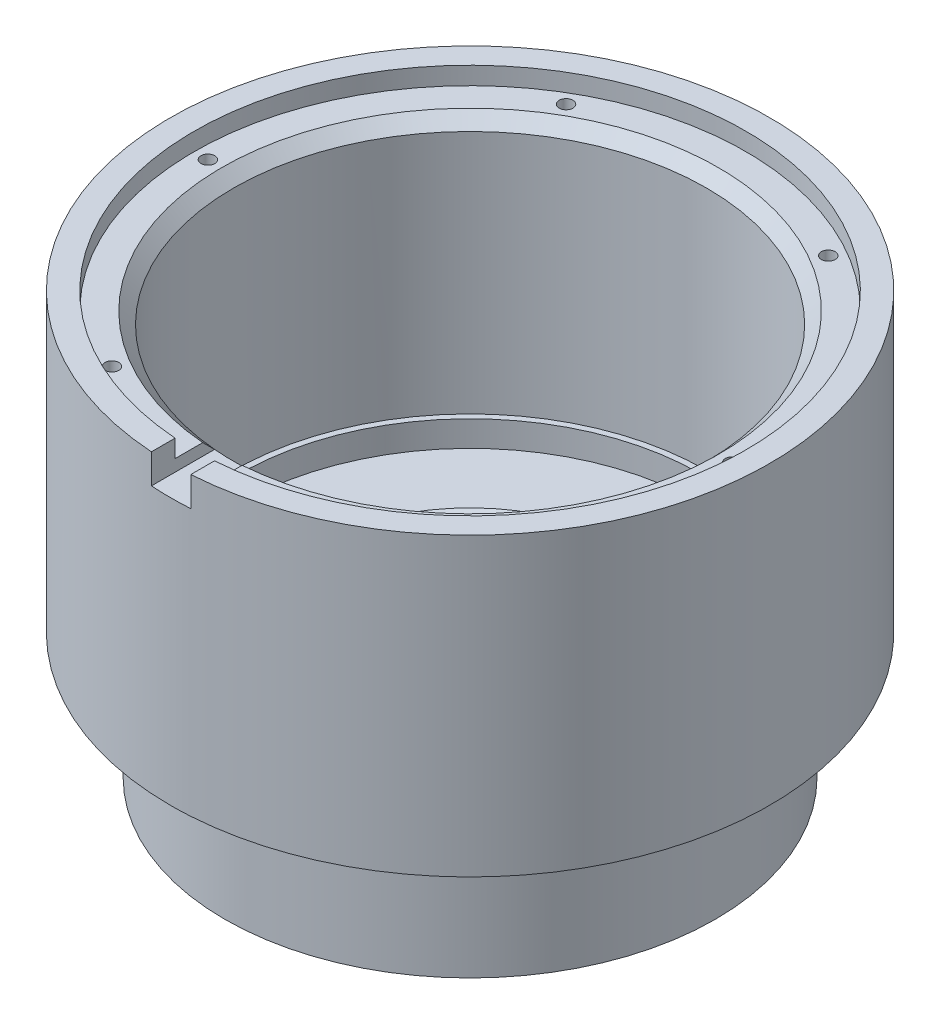
from build123d import *

# Parameters (mm, degrees)
CHAMFER1_SIZE     = 1.5
WIRE_START        = -3.75
SKETCH8_W         = 5
SKETCH8_H         = 8.104217416
WIRE_HOLE_DEPTH   = 3.75
SKETCH9_R         = 0.875
FRONT_HOLES_DEPTH = 6
SKETCH10_R        = 2.875
BACK_HOLES_DEPTH  = 8


with BuildPart() as part:
    # Sketch7 → Base Motor Housing (revolve)
    with BuildSketch(Plane.XY, mode=Mode.PRIVATE) as base_motor_housing_sk:
        Polygon((-38.0375, 39.31), (-35.0375, 39.31), (-35.0375, 37.06), (-30.0375, 37.06), (-30.0375, 4.505), (-29.2875, 4.505), (-29.2875, 1.25), (-20.0375, 1.25), (-12.5, -1.25), (-12.5, -14.25), (-38.0375, -14.25), align=None)
    revolve(base_motor_housing_sk.sketch.rotate(Axis((0, -30.231871117, 0), (0, 1, 0)), 270), axis=Axis((0, -30.231871117, 0), (0, 1, 0)))

    # Chamfer1
    chamfer1_edges = [part.edges().sort_by_distance(p)[0] for p in [
        (0, 37.06, 30.0375),
    ]]
    chamfer(chamfer1_edges, length=CHAMFER1_SIZE)

    # Sketch8 → Wire Hole (cut)
    with BuildSketch(Plane(origin=(0, 39.31, 0), x_dir=(1, 0, 0), z_dir=(0, 1, 0)).offset(WIRE_START)):
        with Locations((0, -33.985391292)):
            Rectangle(SKETCH8_W, SKETCH8_H)
    extrude(amount=WIRE_HOLE_DEPTH, mode=Mode.SUBTRACT)

    # Sketch9 → Front-Holes (cut)
    with BuildSketch(Plane(origin=(0, 37.06, 0), x_dir=(1, 0, 0), z_dir=(0, 1, 0))):
        with Locations(Location((-33.2875, 0, 0), (0, 0, 270))):
            Circle(SKETCH9_R)
        with Locations(Location((-16.64375, 28.827820628, 0), (0, 0, 270))):
            Circle(SKETCH9_R)
        with Locations(Location((16.64375, 28.827820628, 0), (0, 0, 270))):
            Circle(SKETCH9_R)
        with Locations(Location((33.2875, 0, 0), (0, 0, 270))):
            Circle(SKETCH9_R)
        with Locations(Location((16.64375, -28.827820628, 0), (0, 0, 270))):
            Circle(SKETCH9_R)
        with Locations(Location((-16.64375, -28.827820628, 0), (0, 0, 270))):
            Circle(SKETCH9_R)
    extrude(amount=-FRONT_HOLES_DEPTH, mode=Mode.SUBTRACT)

    # Sketch10 → Back-Holes (cut)
    with BuildSketch(Plane.XZ.offset(14.25)):
        with Locations(Location((-25.26875, 0, 0), (0, 0, 270))):
            Circle(SKETCH10_R)
        with Locations(Location((-12.634375, 21.883379422, 0), (0, 0, 270))):
            Circle(SKETCH10_R)
        with Locations(Location((12.634375, 21.883379422, 0), (0, 0, 270))):
            Circle(SKETCH10_R)
        with Locations(Location((25.26875, 0, 0), (0, 0, 270))):
            Circle(SKETCH10_R)
        with Locations(Location((12.634375, -21.883379422, 0), (0, 0, 270))):
            Circle(SKETCH10_R)
        with Locations(Location((-12.634375, -21.883379422, 0), (0, 0, 270))):
            Circle(SKETCH10_R)
    extrude(amount=-BACK_HOLES_DEPTH, mode=Mode.SUBTRACT)

    # Sketch11 → Cut-Revolve1 (revolve, cut)
    with BuildSketch(Plane.XY, mode=Mode.PRIVATE) as cut_revolve1_sk:
        Polygon((31.14375, -14.25), (31.14375, -2.25), (38.0375, 1.730108418), (38.0375, -14.25), align=None)
    revolve(cut_revolve1_sk.sketch.rotate(Axis((0, 0, 0), (0, -1, 0)), 90), axis=Axis((0, 0, 0), (0, -1, 0)), mode=Mode.SUBTRACT)


solid = part.part
